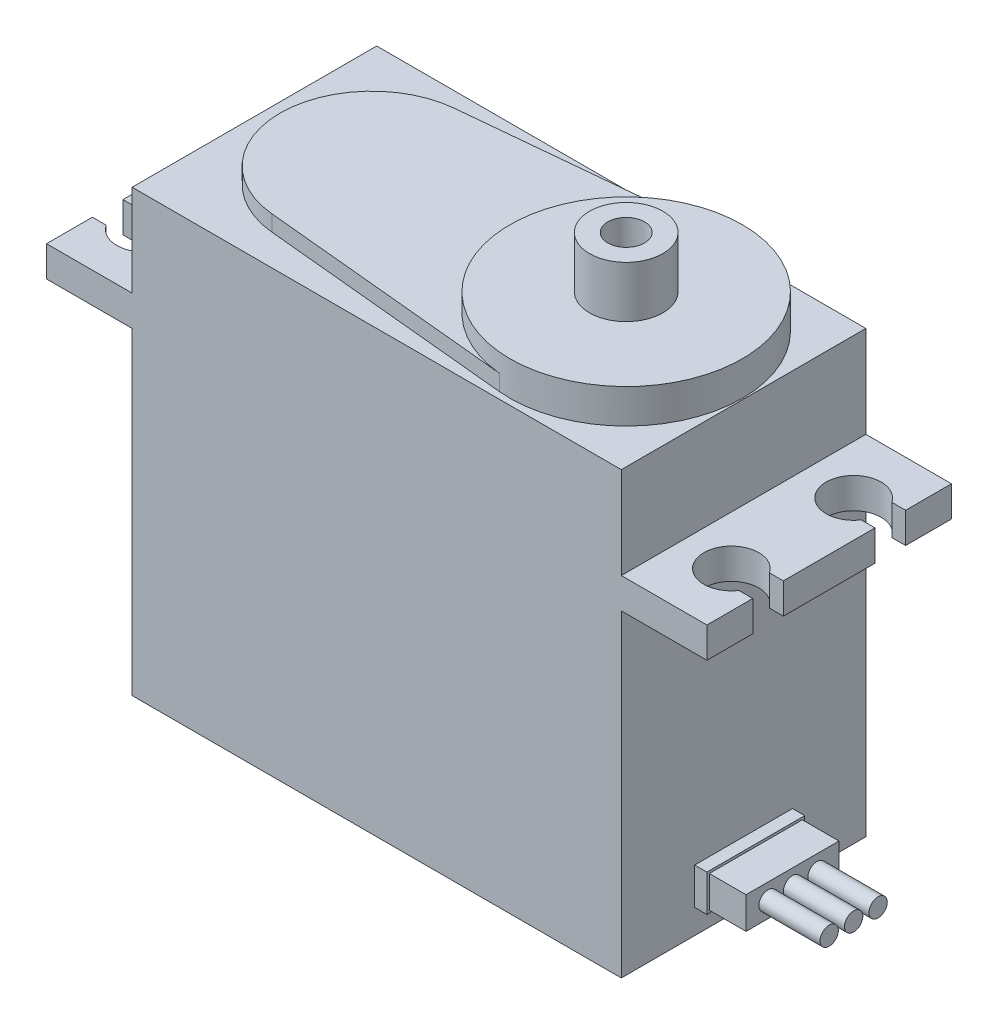
from build123d import *

# Parameters (mm, degrees)
SKETCH_1_W          = 40
SKETCH_1_H          = 20
EXTRUDE_1_DEPTH     = 26
EXTRUDE_2_DEPTH     = 2.5
SKETCH_3_W          = 40
SKETCH_3_H          = 20
EXTRUDE_3_DEPTH     = 7.5
EXTRUDE_4_DEPTH     = 1.3
SKETCH_5_R          = 9.5
EXTRUDE_5_DEPTH     = 1.5
SKETCH_6_R          = 3
EXTRUDE_6_DEPTH     = 4.2
SKETCH_7_W          = 8
SKETCH_7_H          = 3
EXTRUDE_7_DEPTH     = 1
SKETCH_8_W          = 7.6
SKETCH_8_H          = 2.6
EXTRUDE_8_DEPTH     = 3
SKETCH_9_R          = 0.75
EXTRUDE_9_DEPTH     = 5
SKETCH_10_R         = 1.5
CUT_EXTRUDE_1_DEPTH = 3


with BuildPart() as part:
    # 스케치1 → 보스-돌출1 (new body)
    with BuildSketch(Plane(origin=(0, 0, 0), x_dir=(1, 0, 0), z_dir=(0, 1, 0))):
        Rectangle(SKETCH_1_W, SKETCH_1_H)
    extrude(amount=EXTRUDE_1_DEPTH)

    # 스케치2 → 보스-돌출2 (add)
    with BuildSketch(Plane(origin=(0, 26, 0), x_dir=(1, 0, 0), z_dir=(0, 1, 0))):
        with BuildLine():
            Line((-27, 10), (27, 10))
            Line((27, 10), (27, 6.25))
            Line((27, 6.25), (25.868643032, 6.25))
            ThreePointArc((25.868643032, 6.25), (21.751817004, 5), (25.868643032, 3.75))
            Line((25.868643032, 3.75), (27, 3.75))
            Line((27, 3.75), (27, -3.75))
            Line((27, -3.75), (25.866173833, -3.75))
            ThreePointArc((25.866173833, -3.75), (21.753868932, -5), (25.866173833, -6.25))
            Line((25.866173833, -6.25), (27, -6.25))
            Line((27, -6.25), (27, -10))
            Line((27, -10), (-27, -10))
            Line((-27, -10), (-27, -6.25))
            Line((-27, -6.25), (-25.870828693, -6.25))
            ThreePointArc((-25.870828693, -6.25), (-21.75, -5), (-25.870828693, -3.75))
            Line((-25.870828693, -3.75), (-27, -3.75))
            Line((-27, -3.75), (-27, 3.75))
            Line((-27, 3.75), (-25.870828693, 3.75))
            ThreePointArc((-25.870828693, 3.75), (-21.75, 5), (-25.870828693, 6.25))
            Line((-25.870828693, 6.25), (-27, 6.25))
            Line((-27, 6.25), (-27, 10))
        make_face()
    extrude(amount=EXTRUDE_2_DEPTH)

    # 스케치3 → 보스-돌출3 (add)
    with BuildSketch(Plane(origin=(0, 28.5, 0), x_dir=(1, 0, 0), z_dir=(0, 1, 0))):
        Rectangle(SKETCH_3_W, SKETCH_3_H)
    extrude(amount=EXTRUDE_3_DEPTH)

    # 스케치4 → 보스-돌출4 (add)
    with BuildSketch(Plane(origin=(0, 36, 0), x_dir=(1, 0, 0), z_dir=(0, 1, 0))):
        with BuildLine():
            Line((-11.105930899, 7.466746492), (9.486550883, 9.4559828))
            ThreePointArc((9.486550883, 9.4559828), (19.9, -1.9624e-05), (9.486511816, -9.455979026))
            Line((9.486511816, -9.455979026), (-11.105960469, -7.466657767))
            ThreePointArc((-11.105960469, -7.466657767), (-17.9, 5.7816e-05), (-11.105930899, 7.466746492))
        make_face()
    extrude(amount=EXTRUDE_4_DEPTH)

    # 스케치5 → 보스-돌출5 (add)
    with BuildSketch(Plane(origin=(0, 37.3, 0), x_dir=(1, 0, 0), z_dir=(0, 1, 0))):
        with Locations(Location((10.4, 0, 0), (0, 0, 95.517659112))):
            Circle(SKETCH_5_R)
    extrude(amount=EXTRUDE_5_DEPTH)

    # 스케치6 → 보스-돌출6 (add)
    with BuildSketch(Plane(origin=(0, 38.8, 0), x_dir=(1, 0, 0), z_dir=(0, 1, 0))):
        with Locations(Location((10.4, 0, 0), (0, 0, 270))):
            Circle(SKETCH_6_R)
    extrude(amount=EXTRUDE_6_DEPTH)

    # 스케치7 → 보스-돌출7 (add)
    with BuildSketch(Plane(origin=(20, 0, 0), x_dir=(0, 0, -1), z_dir=(1, 0, 0))):
        with Locations((0, 3.5)):
            Rectangle(SKETCH_7_W, SKETCH_7_H)
    extrude(amount=EXTRUDE_7_DEPTH)

    # 스케치8 → 보스-돌출8 (add)
    with BuildSketch(Plane(origin=(21, 0, 0), x_dir=(0, 0, -1), z_dir=(1, 0, 0))):
        with Locations((0, 3.5)):
            Rectangle(SKETCH_8_W, SKETCH_8_H)
    extrude(amount=EXTRUDE_8_DEPTH)

    # 스케치9 → 보스-돌출9 (add)
    with BuildSketch(Plane(origin=(24, 0, 0), x_dir=(0, 0, -1), z_dir=(1, 0, 0))):
        with Locations((0, 3.505070748)):
            Circle(SKETCH_9_R)
        with Locations((-1.999991967, 3.499402084)):
            Circle(SKETCH_9_R)
        with Locations((1.99999474, 3.500483844)):
            Circle(SKETCH_9_R)
    extrude(amount=EXTRUDE_9_DEPTH)

    # 스케치10 → 컷-돌출1 (cut)
    with BuildSketch(Plane(origin=(0, 43, 0), x_dir=(1, 0, 0), z_dir=(0, 1, 0))):
        with Locations(Location((10.4, 0, 0), (0, 0, 270))):
            Circle(SKETCH_10_R)
    extrude(amount=-CUT_EXTRUDE_1_DEPTH, mode=Mode.SUBTRACT)


solid = part.part
